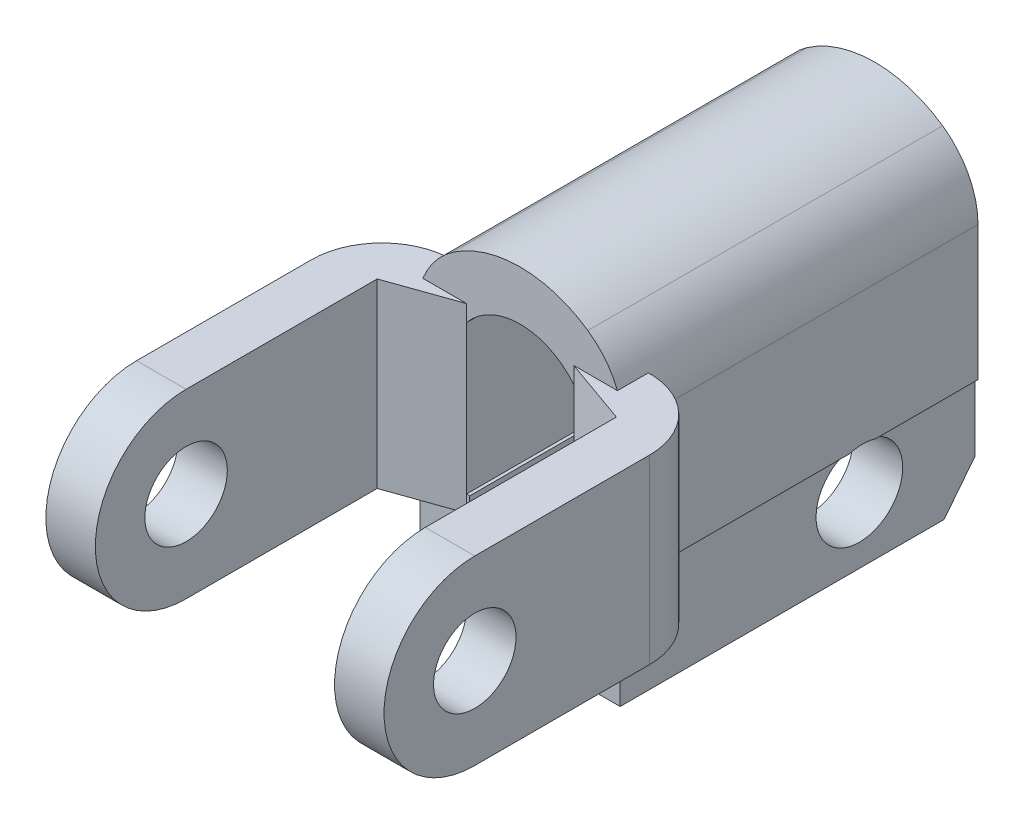
from build123d import *

# Parameters (mm, degrees)
BOSS_EXTRUDE1_DEPTH      = 43
BOSS_EXTRUDE2_DEPTH      = 11
BOSS_EXTRUDE2_DEPTH_BACK = 11
CUT_EXTRUDE1_DEPTH       = 87.401678224
CUT_EXTRUDE1_DEPTH_BACK  = 87.401678224
SKETCH3_R                = 5.25
SKETCH3_R_2              = 5


with BuildPart() as part:
    # Sketch1 → Boss-Extrude1 (new body)
    with BuildSketch(Plane.XY):
        with BuildLine():
            Line((-6.5, 9), (-6.5, -9))
            Line((-6.5, -9), (-6.119061554, -9))
            Line((-6.119061554, -9), (-6.119061554, -22))
            Line((-6.119061554, -22), (-12.119061554, -22))
            Line((-12.119061554, -22), (-12.119061554, -8.960698063))
            Line((-12.119061554, -8.960698063), (-12.5, -8.960698063))
            Line((-12.5, -8.960698063), (-12.5, 7.308339657))
            ThreePointArc((-12.5, 7.308339657), (-11.36319561, 11.939080805), (-8.211247284, 15.51697258))
            ThreePointArc((-8.211247284, 15.51697258), (0, 18.0924797), (8.211247284, 15.51697258))
            ThreePointArc((8.211247284, 15.51697258), (11.36319561, 11.939080805), (12.5, 7.308339657))
            Line((12.5, 7.308339657), (12.5, -8.989240444))
            Line((12.5, -8.989240444), (12.119061554, -8.989240444))
            Line((12.119061554, -8.989240444), (12.119061554, -22))
            Line((12.119061554, -22), (6.119061554, -22))
            Line((6.119061554, -22), (6.119061554, -9))
            Line((6.119061554, -9), (6.5, -9))
            Line((6.5, -9), (6.5, 9))
            ThreePointArc((6.5, 9), (0, 12.0924797), (-6.5, 9))
        make_face()
    extrude(amount=BOSS_EXTRUDE1_DEPTH)

    # Sketch2 → Boss-Extrude2 (add, two sides: drawn at the far end of the back side and taken through both)
    with BuildSketch(Plane(origin=(0, 0, 0), x_dir=(1, 0, 0), z_dir=(0, 1, 0)).offset(-BOSS_EXTRUDE2_DEPTH_BACK)):
        with BuildLine():
            Line((-20.5, -81), (-20.5, -47.820060952))
            ThreePointArc((-20.5, -47.820060952), (-18.187988462, -41.966506434), (-12.5, -39.272757167))
            Line((-12.5, -39.272757167), (-6.5, -39.272757167))
            Line((-6.5, -39.272757167), (-6.5, -43))
            Line((-6.5, -43), (-14.5, -45.836759656))
            Line((-14.5, -45.836759656), (-14.5, -81))
            Line((-14.5, -81), (-20.5, -81))
        make_face()
        with BuildLine():
            Line((6.5, -39.272757167), (12.5, -39.272757167))
            ThreePointArc((12.5, -39.272757167), (18.187988462, -41.966506434), (20.5, -47.820060952))
            Line((20.5, -47.820060952), (20.5, -81))
            Line((20.5, -81), (14.5, -81))
            Line((14.5, -81), (14.5, -45.836759656))
            Line((14.5, -45.836759656), (6.5, -43))
            Line((6.5, -43), (6.5, -39.272757167))
        make_face()
    extrude(amount=BOSS_EXTRUDE2_DEPTH + BOSS_EXTRUDE2_DEPTH_BACK)

    # Sketch3 → Cut-Extrude1 (cut, two sides: drawn at the far end of the back side and taken through both)
    with BuildSketch(Plane(origin=(0, 0, 0), x_dir=(0, 0, -1), z_dir=(1, 0, 0)).offset(-CUT_EXTRUDE1_DEPTH_BACK)):
        with Locations(Location((-14, -14, 0), (0, 0, 72.247209838))):
            Circle(SKETCH3_R)
        with Locations((-69, 0)):
            Circle(SKETCH3_R_2)
        Polygon((-5.082033537, -23.71409096), (2.018266343, -14.692533465), (6.529045091, -36.912295444), align=None)
        with BuildLine():
            Line((-69, 11), (-69, 14.018852996))
            Line((-69, 14.018852996), (-85.29582804, 14.018852996))
            Line((-85.29582804, 14.018852996), (-85.29582804, -20.343414377))
            Line((-85.29582804, -20.343414377), (-69, -16.597000701))
            Line((-69, -16.597000701), (-69, -11))
            ThreePointArc((-69, -11), (-80, 0), (-69, 11))
        make_face()
    extrude(amount=CUT_EXTRUDE1_DEPTH + CUT_EXTRUDE1_DEPTH_BACK, mode=Mode.SUBTRACT)


solid = part.part
